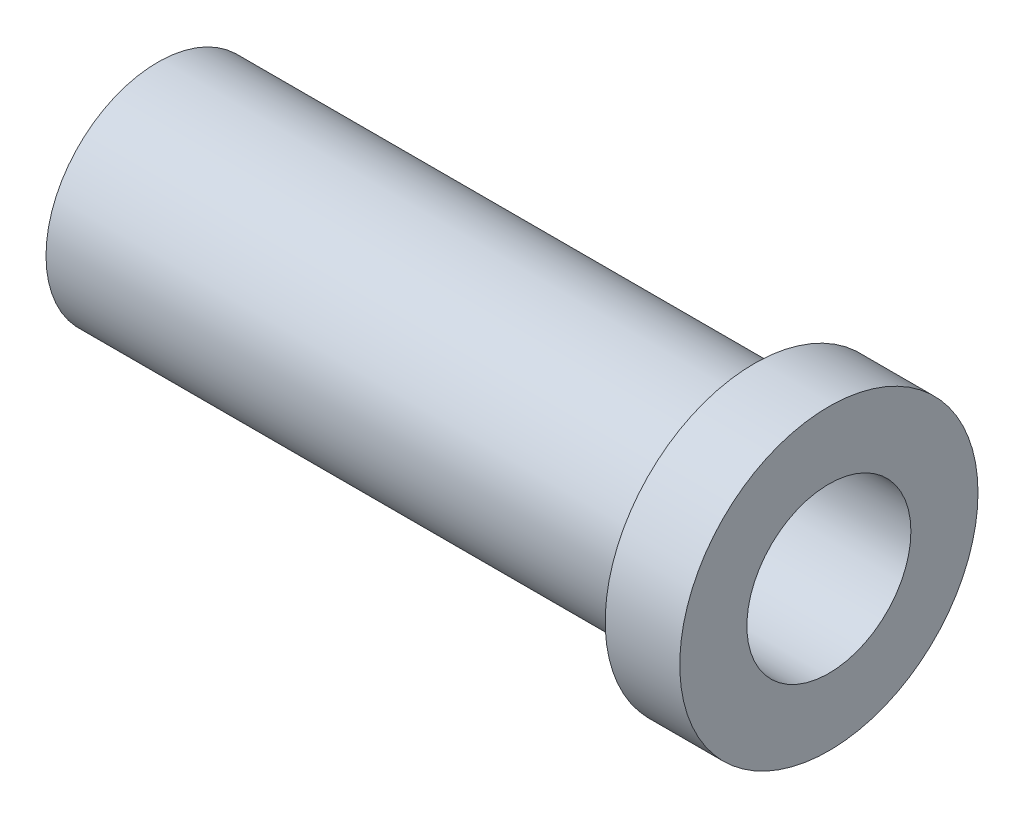
from build123d import *

# Parameters (mm, degrees)
SKETCH2_R           = 10
BOSS_EXTRUDE1_DEPTH = 5
SKETCH3_R           = 7.5
BOSS_EXTRUDE2_DEPTH = 40
SKETCH6_R           = 5.5
CUT_EXTRUDE1_DEPTH  = 48.16990566


with BuildPart() as part:
    # Sketch2 → Boss-Extrude1 (new body)
    with BuildSketch(Plane(origin=(0, 0, 0), x_dir=(0, 0, -1), z_dir=(1, 0, 0))):
        Circle(SKETCH2_R)
    extrude(amount=BOSS_EXTRUDE1_DEPTH)

    # Sketch3 → Boss-Extrude2 (add)
    with BuildSketch(Plane.ZY):
        Circle(SKETCH3_R)
    extrude(amount=BOSS_EXTRUDE2_DEPTH)

    # Sketch6 → Cut-Extrude1 (cut, through all)
    with BuildSketch(Plane(origin=(5, 0, 0), x_dir=(0, 0, -1), z_dir=(1, 0, 0))):
        Circle(SKETCH6_R)
    extrude(amount=-CUT_EXTRUDE1_DEPTH, mode=Mode.SUBTRACT)


solid = part.part
